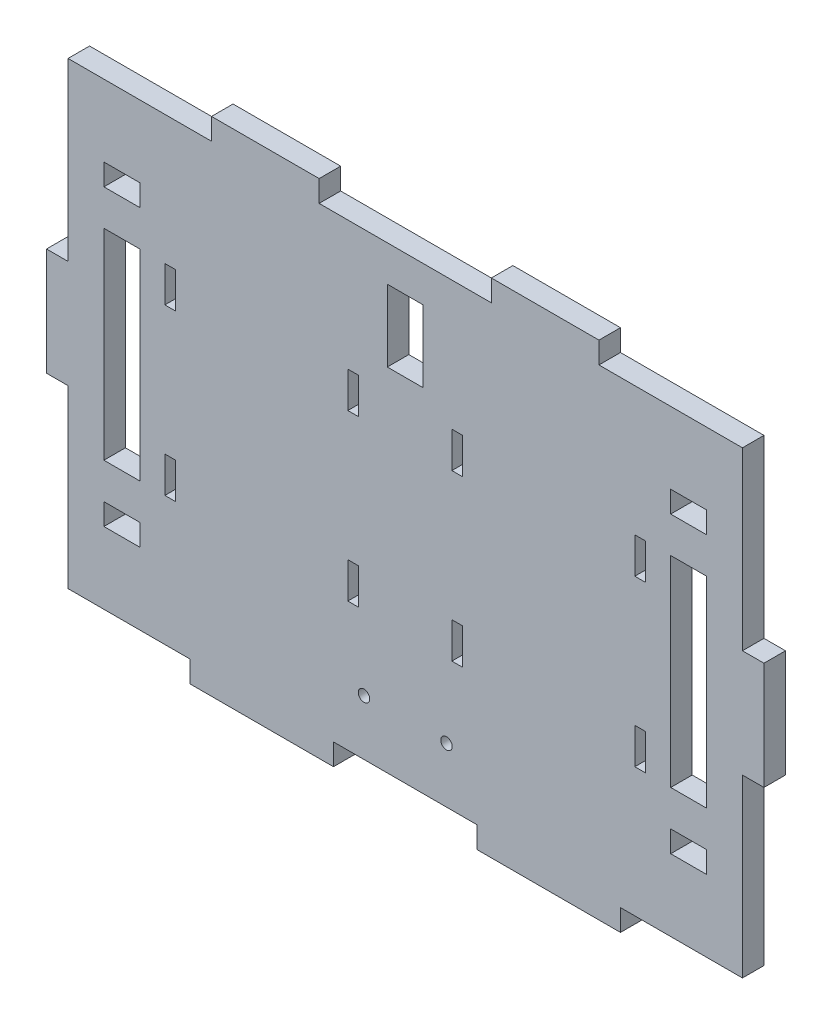
from build123d import *

# Parameters (mm, degrees)
BOSS_EXTRU_3_DEPTH      = 6
ESQUISSE2_W             = 3
ESQUISSE2_H             = 10
ENL_V_MAT_EXTRU_1_DEPTH = 10
ESQUISSE3_W             = 10
ESQUISSE3_H             = 6
ENL_V_MAT_EXTRU_2_DEPTH = 6
ESQUISSE4_W             = 10
ESQUISSE4_H             = 56
ENL_V_MAT_EXTRU_3_DEPTH = 6
ESQUISSE5_W             = 10
ESQUISSE5_H             = 20
ENL_V_MAT_EXTRU_4_DEPTH = 123.21292894
ESQUISSE6_R             = 1.6
ENL_V_MAT_EXTRU_5_DEPTH = 123.21292894


with BuildPart() as part:
    # Esquisse1 → Boss.-Extru.3 (new body)
    with BuildSketch(Plane.XY):
        Polygon((-94, 64), (-94, 15), (-100, 15), (-100, -15), (-94, -15), (-94, -64), (-60, -64), (-60, -70), (-20, -70), (-20, -64), (20, -64), (20, -70), (60, -70), (60, -64), (94, -64), (94, -15), (100, -15), (100, 15), (94, 15), (94, 64), (54, 64), (54, 70), (24, 70), (24, 64), (-24, 64), (-24, 70), (-54, 70), (-54, 64), align=None)
    extrude(amount=BOSS_EXTRU_3_DEPTH)

    # Esquisse2 → Enlèv. mat.-Extru.1 (cut)
    with BuildSketch(Plane.XY.offset(6)):
        with Locations((-65.5, -23)):
            Rectangle(ESQUISSE2_W, ESQUISSE2_H)
        with Locations((-65.5, 23)):
            Rectangle(ESQUISSE2_W, ESQUISSE2_H)
        with Locations((-14.5, -23)):
            Rectangle(ESQUISSE2_W, ESQUISSE2_H)
        with Locations((-14.5, 23)):
            Rectangle(ESQUISSE2_W, ESQUISSE2_H)
        with Locations((65.5, -23)):
            Rectangle(ESQUISSE2_W, ESQUISSE2_H)
        with Locations((14.5, 23)):
            Rectangle(ESQUISSE2_W, ESQUISSE2_H)
        with Locations((14.5, -23)):
            Rectangle(ESQUISSE2_W, ESQUISSE2_H)
        with Locations((65.5, 23)):
            Rectangle(ESQUISSE2_W, ESQUISSE2_H)
    extrude(amount=-ENL_V_MAT_EXTRU_1_DEPTH, mode=Mode.SUBTRACT)

    # Esquisse3 → Enlèv. mat.-Extru.2 (cut)
    with BuildSketch(Plane.XY.offset(6)):
        with Locations((-79, -41)):
            Rectangle(ESQUISSE3_W, ESQUISSE3_H)
        with Locations((79, -41)):
            Rectangle(ESQUISSE3_W, ESQUISSE3_H)
        with Locations((79, 41)):
            Rectangle(ESQUISSE3_W, ESQUISSE3_H)
        with Locations((-79, 41)):
            Rectangle(ESQUISSE3_W, ESQUISSE3_H)
    extrude(amount=-ENL_V_MAT_EXTRU_2_DEPTH, mode=Mode.SUBTRACT)

    # Esquisse4 → Enlèv. mat.-Extru.3 (cut)
    with BuildSketch(Plane(origin=(0, 0, 0), x_dir=(-1, 0, 0), z_dir=(0, 0, -1))):
        with Locations((79, 0)):
            Rectangle(ESQUISSE4_W, ESQUISSE4_H)
        with Locations((-79, 0)):
            Rectangle(ESQUISSE4_W, ESQUISSE4_H)
    extrude(amount=-ENL_V_MAT_EXTRU_3_DEPTH, mode=Mode.SUBTRACT)

    # Esquisse5 → Enlèv. mat.-Extru.4 (cut, through all)
    with BuildSketch(Plane(origin=(0, 0, 0), x_dir=(-1, 0, 0), z_dir=(0, 0, -1))):
        with Locations((0, 44)):
            Rectangle(ESQUISSE5_W, ESQUISSE5_H)
    extrude(amount=-ENL_V_MAT_EXTRU_4_DEPTH, mode=Mode.SUBTRACT)

    # Esquisse6 → Enlèv. mat.-Extru.5 (cut, through all)
    with BuildSketch(Plane(origin=(0, 0, 0), x_dir=(-1, 0, 0), z_dir=(0, 0, -1))):
        with Locations((-11.5, -48.6)):
            Circle(ESQUISSE6_R)
        with Locations((11.5, -48.6)):
            Circle(ESQUISSE6_R)
    extrude(amount=-ENL_V_MAT_EXTRU_5_DEPTH, mode=Mode.SUBTRACT)


solid = part.part
